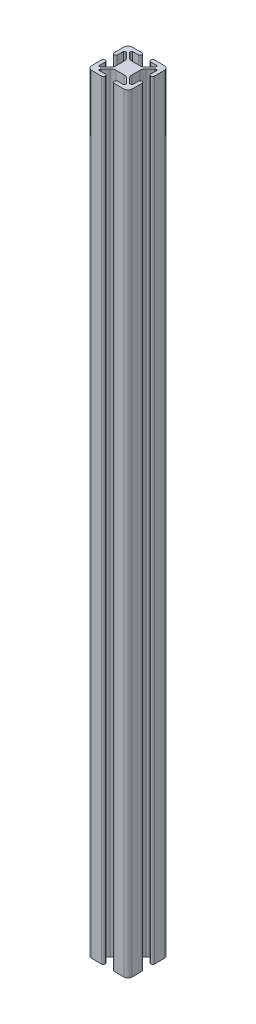
from build123d import *

# Parameters (mm, degrees)
EXTRUDE_1_DEPTH = 380


with BuildPart() as part:
    # 草图2 → 凸台-拉伸1 (new body)
    with BuildSketch(Plane(origin=(0, 0, 0), x_dir=(1, 0, 0), z_dir=(0, 1, 0))):
        with BuildLine():
            Line((-1.042752475, -10.085861632), (3.857247525, -10.085861632))
            ThreePointArc((3.857247525, -10.085861632), (4.757247525, -10.985861632), (3.857247525, -11.885861632))
            Line((3.857247525, -11.885861632), (1.076161722, -11.885861632))
            ThreePointArc((1.076161722, -11.885861632), (0.722608332, -12.032308241), (0.576161722, -12.385861632))
            Line((0.576161722, -12.385861632), (0.576161722, -12.790788968))
            ThreePointArc((0.576161722, -12.790788968), (0.614221956, -12.982130685), (0.722608332, -13.144342359))
            Line((0.722608332, -13.144342359), (2.885447948, -15.307181975))
            ThreePointArc((2.885447948, -15.307181975), (3.858717994, -15.957500229), (5.006768291, -16.185861632))
            Line((5.006768291, -16.185861632), (8.907726758, -16.185861632))
            ThreePointArc((8.907726758, -16.185861632), (10.055777055, -15.957500229), (11.029047102, -15.307181975))
            Line((11.029047102, -15.307181975), (13.191886718, -13.144342359))
            ThreePointArc((13.191886718, -13.144342359), (13.300273094, -12.982130685), (13.338333327, -12.790788968))
            Line((13.338333327, -12.790788968), (13.338333327, -12.385861632))
            ThreePointArc((13.338333327, -12.385861632), (13.191886718, -12.032308241), (12.838333327, -11.885861632))
            Line((12.838333327, -11.885861632), (10.057247525, -11.885861632))
            ThreePointArc((10.057247525, -11.885861632), (9.157247525, -10.985861632), (10.057247525, -10.085861632))
            Line((10.057247525, -10.085861632), (14.957247525, -10.085861632))
            ThreePointArc((14.957247525, -10.085861632), (16.371461087, -10.671648069), (16.957247525, -12.085861632))
            Line((16.957247525, -12.085861632), (16.957247525, -16.985861632))
            ThreePointArc((16.957247525, -16.985861632), (16.057247525, -17.885861632), (15.157247525, -16.985861632))
            Line((15.157247525, -16.985861632), (15.157247525, -14.204775829))
            ThreePointArc((15.157247525, -14.204775829), (15.010800915, -13.851222438), (14.657247525, -13.704775829))
            Line((14.657247525, -13.704775829), (14.252320188, -13.704775829))
            ThreePointArc((14.252320188, -13.704775829), (14.060978472, -13.742836063), (13.898766797, -13.851222438))
            Line((13.898766797, -13.851222438), (11.735927181, -16.014062054))
            ThreePointArc((11.735927181, -16.014062054), (11.085608927, -16.987332101), (10.857247525, -18.135382398))
            Line((10.857247525, -18.135382398), (10.857247525, -22.036340865))
            ThreePointArc((10.857247525, -22.036340865), (11.085608927, -23.184391162), (11.735927181, -24.157661209))
            Line((11.735927181, -24.157661209), (13.898766797, -26.320500825))
            ThreePointArc((13.898766797, -26.320500825), (14.060978472, -26.4288872), (14.252320188, -26.466947434))
            Line((14.252320188, -26.466947434), (14.657247525, -26.466947434))
            ThreePointArc((14.657247525, -26.466947434), (15.010800915, -26.320500825), (15.157247525, -25.966947434))
            Line((15.157247525, -25.966947434), (15.157247525, -23.185861632))
            ThreePointArc((15.157247525, -23.185861632), (16.057247525, -22.285861632), (16.957247525, -23.185861632))
            Line((16.957247525, -23.185861632), (16.957247525, -28.085861632))
            ThreePointArc((16.957247525, -28.085861632), (16.371461087, -29.500075194), (14.957247525, -30.085861632))
            Line((14.957247525, -30.085861632), (10.057247525, -30.085861632))
            ThreePointArc((10.057247525, -30.085861632), (9.157247525, -29.185861632), (10.057247525, -28.285861632))
            Line((10.057247525, -28.285861632), (12.838333327, -28.285861632))
            ThreePointArc((12.838333327, -28.285861632), (13.191886718, -28.139415022), (13.338333327, -27.785861632))
            Line((13.338333327, -27.785861632), (13.338333327, -27.380934295))
            ThreePointArc((13.338333327, -27.380934295), (13.300273094, -27.189592579), (13.191886718, -27.027380904))
            Line((13.191886718, -27.027380904), (11.029047102, -24.864541288))
            ThreePointArc((11.029047102, -24.864541288), (10.055777055, -24.214223034), (8.907726758, -23.985861632))
            Line((8.907726758, -23.985861632), (5.006768291, -23.985861632))
            ThreePointArc((5.006768291, -23.985861632), (3.858717994, -24.214223034), (2.885447948, -24.864541288))
            Line((2.885447948, -24.864541288), (0.722608332, -27.027380904))
            ThreePointArc((0.722608332, -27.027380904), (0.614221956, -27.189592579), (0.576161722, -27.380934295))
            Line((0.576161722, -27.380934295), (0.576161722, -27.785861632))
            ThreePointArc((0.576161722, -27.785861632), (0.722608332, -28.139415022), (1.076161722, -28.285861632))
            Line((1.076161722, -28.285861632), (3.857247525, -28.285861632))
            ThreePointArc((3.857247525, -28.285861632), (4.757247525, -29.185861632), (3.857247525, -30.085861632))
            Line((3.857247525, -30.085861632), (-1.042752475, -30.085861632))
            ThreePointArc((-1.042752475, -30.085861632), (-2.456966038, -29.500075194), (-3.042752475, -28.085861632))
            Line((-3.042752475, -28.085861632), (-3.042752475, -23.185861632))
            ThreePointArc((-3.042752475, -23.185861632), (-2.142752475, -22.285861632), (-1.242752475, -23.185861632))
            Line((-1.242752475, -23.185861632), (-1.242752475, -25.966947434))
            ThreePointArc((-1.242752475, -25.966947434), (-1.096305866, -26.320500825), (-0.742752475, -26.466947434))
            Line((-0.742752475, -26.466947434), (-0.337825138, -26.466947434))
            ThreePointArc((-0.337825138, -26.466947434), (-0.146483422, -26.4288872), (0.015728252, -26.320500825))
            Line((0.015728252, -26.320500825), (2.178567868, -24.157661209))
            ThreePointArc((2.178567868, -24.157661209), (2.828886122, -23.184391162), (3.057247525, -22.036340865))
            Line((3.057247525, -22.036340865), (3.057247525, -18.135382398))
            ThreePointArc((3.057247525, -18.135382398), (2.828886122, -16.987332101), (2.178567868, -16.014062054))
            Line((2.178567868, -16.014062054), (0.015728252, -13.851222438))
            ThreePointArc((0.015728252, -13.851222438), (-0.146483422, -13.742836063), (-0.337825138, -13.704775829))
            Line((-0.337825138, -13.704775829), (-0.742752475, -13.704775829))
            ThreePointArc((-0.742752475, -13.704775829), (-1.096305866, -13.851222438), (-1.242752475, -14.204775829))
            Line((-1.242752475, -14.204775829), (-1.242752475, -16.985861632))
            ThreePointArc((-1.242752475, -16.985861632), (-2.142752475, -17.885861632), (-3.042752475, -16.985861632))
            Line((-3.042752475, -16.985861632), (-3.042752475, -12.085861632))
            ThreePointArc((-3.042752475, -12.085861632), (-2.456966038, -10.671648069), (-1.042752475, -10.085861632))
        make_face()
    extrude(amount=EXTRUDE_1_DEPTH)


solid = part.part
